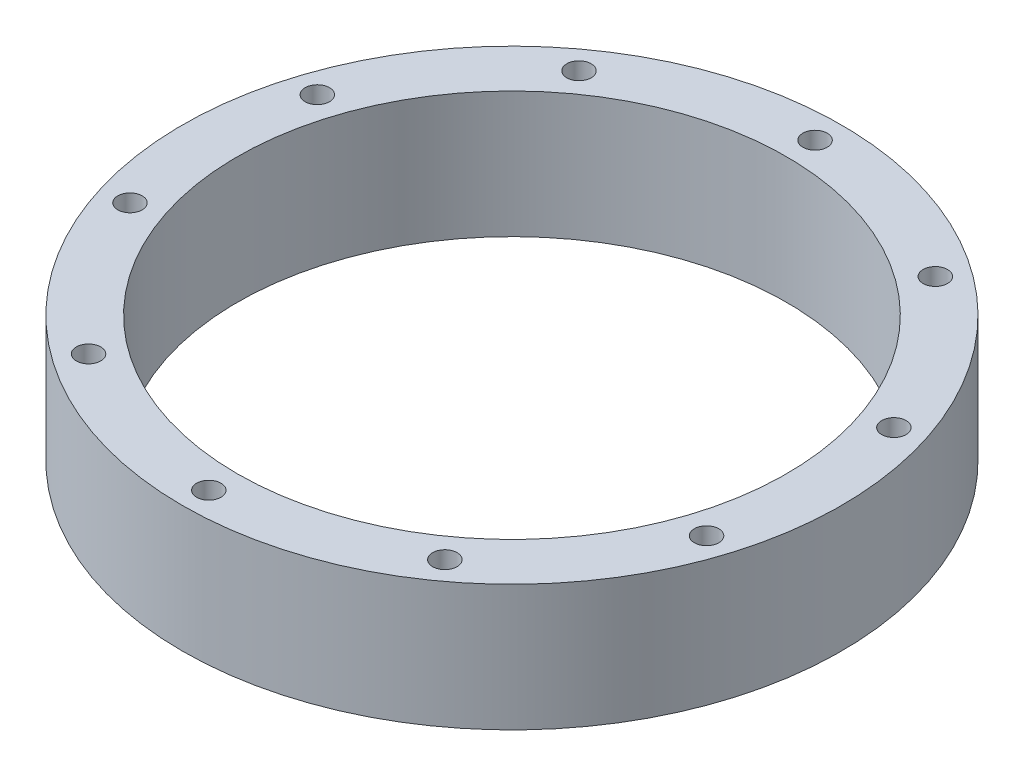
from build123d import *

# Parameters (mm, degrees)
SKETCH1_R           = 40.5
SKETCH1_R_2         = 1.5
SKETCH1_R_3         = 33.75
BOSS_EXTRUDE1_DEPTH = 15.5


with BuildPart() as part:
    # Sketch1 → Boss-Extrude1 (new body)
    with BuildSketch(Plane(origin=(0, 0, 0), x_dir=(1, 0, 0), z_dir=(0, 1, 0))):
        with Locations(Location((0, 0, 0), (0, 0, 270))):
            Circle(SKETCH1_R)
        with Locations(Location((0, 37.25, 0), (0, 0, 270))):
            Circle(SKETCH1_R_2, mode=Mode.SUBTRACT)
        with Locations(Location((21.895000648, 30.13588304, 0), (0, 0, 270))):
            Circle(SKETCH1_R_2, mode=Mode.SUBTRACT)
        with Locations(Location((35.426855232, 11.51088304, 0), (0, 0, 270))):
            Circle(SKETCH1_R_2, mode=Mode.SUBTRACT)
        with Locations(Location((35.426855232, -11.51088304, 0), (0, 0, 270))):
            Circle(SKETCH1_R_2, mode=Mode.SUBTRACT)
        with Locations(Location((21.895000648, -30.13588304, 0), (0, 0, 270))):
            Circle(SKETCH1_R_2, mode=Mode.SUBTRACT)
        with Locations(Location((0, -37.25, 0), (0, 0, 270))):
            Circle(SKETCH1_R_2, mode=Mode.SUBTRACT)
        with Locations(Location((-21.895000648, -30.13588304, 0), (0, 0, 270))):
            Circle(SKETCH1_R_2, mode=Mode.SUBTRACT)
        with Locations(Location((-35.426855232, -11.51088304, 0), (0, 0, 270))):
            Circle(SKETCH1_R_2, mode=Mode.SUBTRACT)
        with Locations(Location((-35.426855232, 11.51088304, 0), (0, 0, 270))):
            Circle(SKETCH1_R_2, mode=Mode.SUBTRACT)
        with Locations(Location((-21.895000648, 30.13588304, 0), (0, 0, 270))):
            Circle(SKETCH1_R_2, mode=Mode.SUBTRACT)
        with Locations(Location((0, 0, 0), (0, 0, 270))):
            Circle(SKETCH1_R_3, mode=Mode.SUBTRACT)
    extrude(amount=BOSS_EXTRUDE1_DEPTH)


solid = part.part
